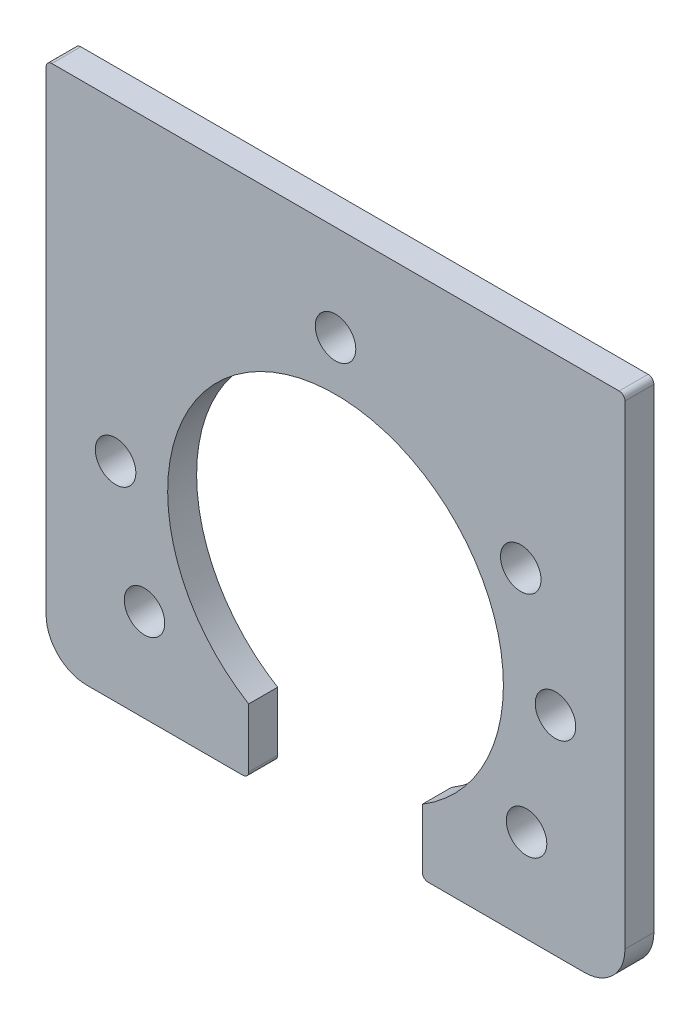
from build123d import *

# Parameters (mm, degrees)
SKETCH1_R           = 3.5
BOSS_EXTRUDE1_DEPTH = 5
FILLET1_R           = 1
FILLET2_R           = 1
FILLET3_R           = 1
FILLET4_R           = 1


with BuildPart() as part:
    # Sketch1 → Boss-Extrude1 (new body)
    with BuildSketch(Plane.XY):
        with BuildLine():
            Line((0, 0), (-100, 0))
            Line((-100, 0), (-100, -80))
            Line((-100, -80), (-100, -83))
            ThreePointArc((-100, -83), (-97.949747468, -87.949747468), (-93, -90))
            Line((-93, -90), (-92, -90))
            Line((-92, -90), (-65, -90))
            Line((-65, -90), (-65, -78.819347292))
            ThreePointArc((-65, -78.819347292), (-50, -25), (-35, -78.819347292))
            Line((-35, -78.819347292), (-35, -90))
            Line((-35, -90), (-8, -90))
            Line((-8, -90), (-7, -90))
            ThreePointArc((-7, -90), (-2.050252532, -87.949747468), (0, -83))
            Line((0, -83), (0, -80))
            Line((0, -80), (0, 0))
        make_face()
        with Locations((-50, -16.5)):
            Circle(SKETCH1_R, mode=Mode.SUBTRACT)
        with Locations((-12, -54)):
            Circle(SKETCH1_R, mode=Mode.SUBTRACT)
        with Locations((-17, -74)):
            Circle(SKETCH1_R, mode=Mode.SUBTRACT)
        with Locations((-18, -35)):
            Circle(SKETCH1_R, mode=Mode.SUBTRACT)
        with Locations(Location((-83, -74, 0), (0, 0, 180))):
            Circle(SKETCH1_R, mode=Mode.SUBTRACT)
        with Locations(Location((-88, -54, 0), (0, 0, 180))):
            Circle(SKETCH1_R, mode=Mode.SUBTRACT)
    extrude(amount=BOSS_EXTRUDE1_DEPTH)

    # Fillet1
    fillet1_edges = [part.edges().sort_by_distance(p)[0] for p in [
        (-100, 0, 2.5),
    ]]
    fillet(fillet1_edges, radius=FILLET1_R)

    # Fillet2
    fillet2_edges = [part.edges().sort_by_distance(p)[0] for p in [
        (0, 0, 2.5),
    ]]
    fillet(fillet2_edges, radius=FILLET2_R)

    # Fillet3
    fillet3_edges = [part.edges().sort_by_distance(p)[0] for p in [
        (-65, -90, 2.5),
    ]]
    fillet(fillet3_edges, radius=FILLET3_R)

    # Fillet4
    fillet4_edges = [part.edges().sort_by_distance(p)[0] for p in [
        (-35, -90, 2.5),
    ]]
    fillet(fillet4_edges, radius=FILLET4_R)


solid = part.part
